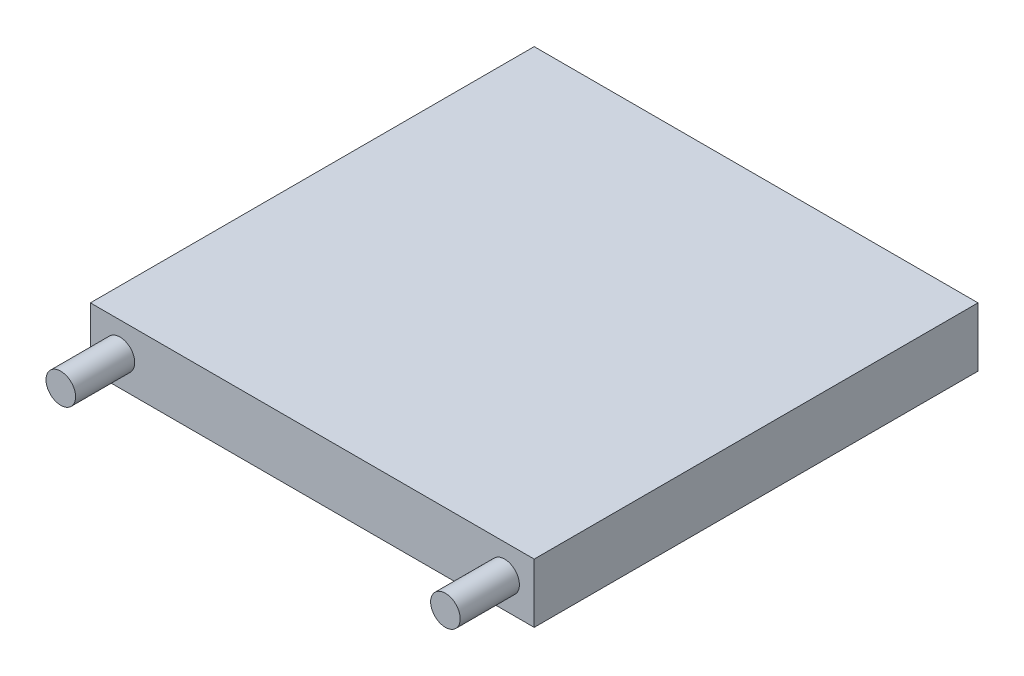
from build123d import *

# Parameters (mm, degrees)
SKETCH1_W           = 30
SKETCH1_H           = 30
BOSS_EXTRUDE1_DEPTH = 4
SKETCH2_R           = 1
BOSS_EXTRUDE2_DEPTH = 4


with BuildPart() as part:
    # Sketch1 → Boss-Extrude1 (new body)
    with BuildSketch(Plane(origin=(0, 0, 0), x_dir=(1, 0, 0), z_dir=(0, 1, 0))):
        Rectangle(SKETCH1_W, SKETCH1_H)
    extrude(amount=BOSS_EXTRUDE1_DEPTH)

    # Sketch2 → Boss-Extrude2 (add)
    with BuildSketch(Plane.XY.offset(15)):
        with Locations(Location((-13, 2, 0), (0, 0, 180))):
            Circle(SKETCH2_R)
        with Locations(Location((13, 2, 0), (0, 0, 180))):
            Circle(SKETCH2_R)
    extrude(amount=BOSS_EXTRUDE2_DEPTH)


solid = part.part
